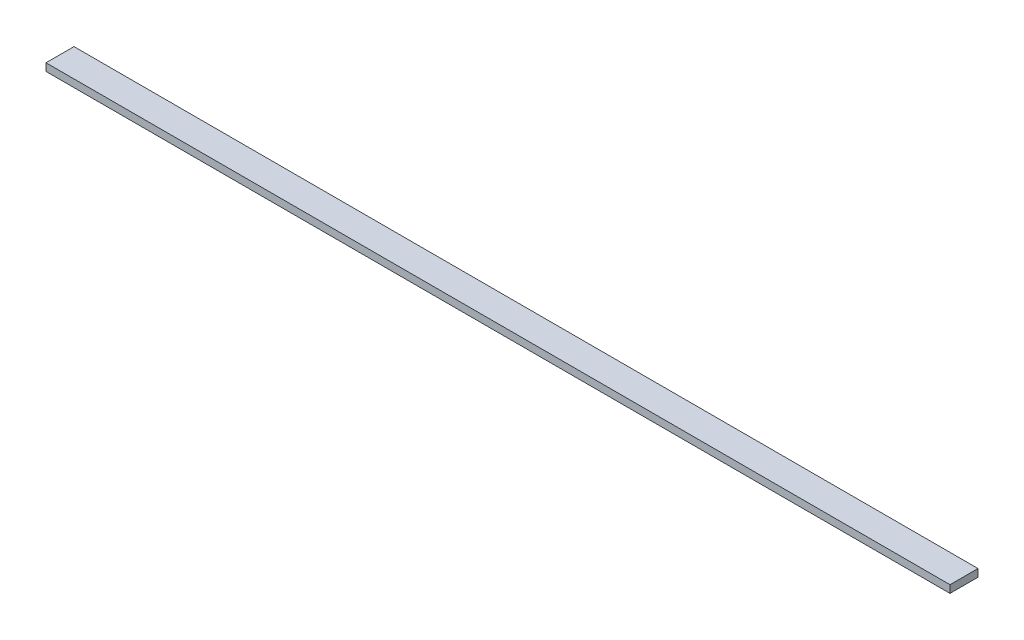
from build123d import *

# Parameters (mm, degrees)
BOSS_EXTRUDE1_DEPTH      = 161.5
BOSS_EXTRUDE1_DEPTH_BACK = 161.5
SKETCH2_W                = 10
SKETCH2_H                = 2.7


with BuildPart() as part:
    # Sketch2 → Boss-Extrude1 (new, two sides: drawn at the far end of the back side and taken through both)
    with BuildSketch(Plane(origin=(0, 0, 0), x_dir=(0, 0, -1), z_dir=(1, 0, 0)).offset(-BOSS_EXTRUDE1_DEPTH_BACK)):
        with Locations((-5, 1.35)):
            Rectangle(SKETCH2_W, SKETCH2_H)
    extrude(amount=BOSS_EXTRUDE1_DEPTH + BOSS_EXTRUDE1_DEPTH_BACK)


solid = part.part
